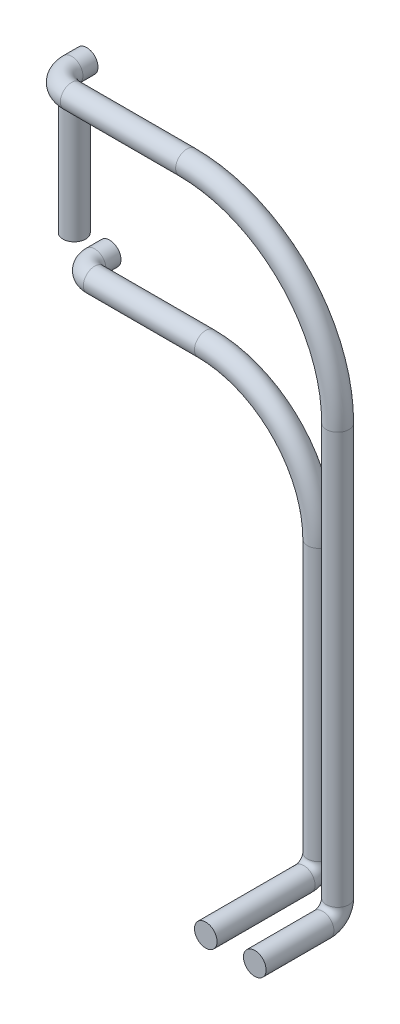
from build123d import *

# Parameters (mm, degrees)
SWEEP1_PROFILE_R = 1.5
SWEEP2_PROFILE_R = 1.5
SWEEP3_PROFILE_R = 1.5


with BuildPart() as part:
    # Sweep1: sweep along a curve in space
    with BuildLine() as sweep1_path:
        Line((0, 0, 0), (0, 0, -13))
        ThreePointArc((0, 0, -13), (0, 0.585786438, -14.414213562), (0, 2, -15))
        Line((0, 2, -15), (0, 38, -15))
        ThreePointArc((-15, 53, -15), (-4.393398282, 48.606601718, -15), (0, 38, -15))
        Line((-15, 53, -15), (-29.75, 53, -15))
        ThreePointArc((-29.75, 53, -15), (-31.164213562, 53, -15.585786438), (-31.75, 53, -17))
        Line((-31.75, 53, -17), (-31.75, 53, -19))
    # Sweep1 profile (on start of the path) → Sweep1 (sweep)
    with BuildSketch(Plane(origin=(0, 0, 0), x_dir=(-1, 0, 0), z_dir=(0, 0, -1))):
        Circle(SWEEP1_PROFILE_R)
    sweep(path=sweep1_path.line)


with BuildPart() as body_2:
    # Sweep2: sweep along a curve in space
    with BuildLine() as sweep2_path:
        Line((-36.45, 53, -19), (-36.45, 69, -19))
    # Sweep2 profile (on start of the path) → Sweep2 (sweep)
    with BuildSketch(Plane(origin=(-36.45, 53, -19), x_dir=(0, 0, 1), z_dir=(0, 1, 0))):
        Circle(SWEEP2_PROFILE_R)
    sweep(path=sweep2_path.line)


with BuildPart() as body_3:
    # Sweep3: sweep along a curve in space
    with BuildLine() as sweep3_path:
        Line((6.5, 0, 0), (6.5, 0, -9))
        ThreePointArc((6.5, 0, -9), (6.5, 0.585786438, -10.414213562), (6.5, 2, -11))
        Line((6.5, 2, -11), (6.5, 56.6, -11))
        ThreePointArc((6.5, 56.6, -11), (0.642135624, 70.742135624, -11), (-13.5, 76.6, -11))
        Line((-13.5, 76.6, -11), (-28.8, 76.6, -11))
        ThreePointArc((-28.8, 76.6, -11), (-30.921320344, 76.6, -11.878679656), (-31.8, 76.6, -14))
        Line((-31.8, 76.6, -14), (-31.8, 76.6, -16))
    # Sweep3 profile (on start of the path) → Sweep3 (sweep)
    with BuildSketch(Plane(origin=(6.5, 0, 0), x_dir=(-1, 0, 0), z_dir=(0, 0, -1))):
        Circle(SWEEP3_PROFILE_R)
    sweep(path=sweep3_path.line)


solid = Compound([part.part, body_2.part, body_3.part])
